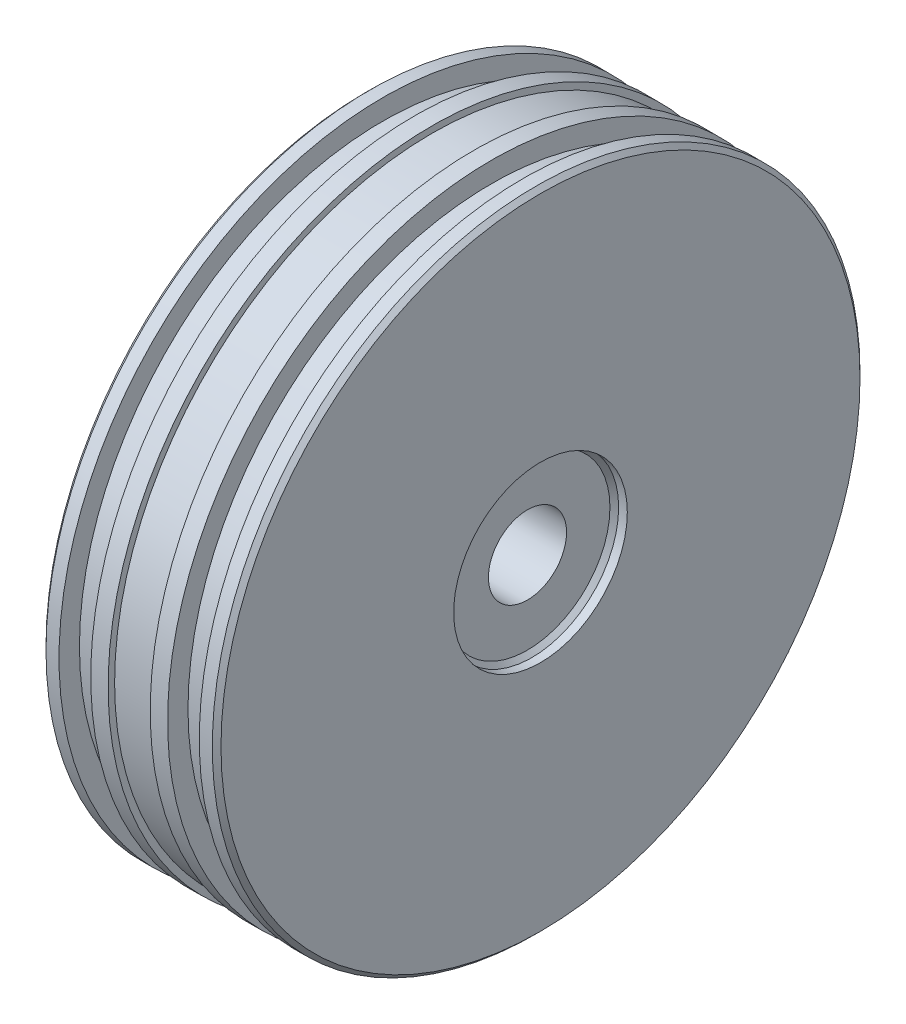
from build123d import *

# Parameters (mm, degrees)
CHAMFER_1_SIZE = 1
CHAMFER_2_SIZE = 3
CHAMFER_3_SIZE = 1


with BuildPart() as part:
    # Эскиз1 → Повернуть1 (revolve)
    with BuildSketch(Plane.XY, mode=Mode.PRIVATE) as revolve_1_sk:
        Polygon((0, 20), (0, 74.59), (4, 74.59), (4, 69.89), (11.3, 69.89), (11.3, 74.59), (15.3, 74.59), (15.3, 73.09), (25, 73.09), (25, 74.59), (29, 74.59), (29, 69.89), (36.3, 69.89), (36.3, 74.59), (40.3, 74.59), (40.3, 20), (37.3, 20), (37.3, 9), (15, 9), (15, 20), align=None)
    revolve(revolve_1_sk.sketch.rotate(Axis((0, 0, 0), (-1, 0, 0)), 90), axis=Axis((0, 0, 0), (-1, 0, 0)))

    # Фаска1
    chamfer_1_edges = [part.edges().sort_by_distance(p)[0] for p in [
        (40.3, 0, 74.59),
        (0, 0, 74.59),
    ]]
    chamfer(chamfer_1_edges, length=CHAMFER_1_SIZE)

    # Фаска2
    chamfer_2_edges = [part.edges().sort_by_distance(p)[0] for p in [
        (15, 0, 20),
    ]]
    chamfer(chamfer_2_edges, length=CHAMFER_2_SIZE)

    # Фаска3
    chamfer_3_edges = [part.edges().sort_by_distance(p)[0] for p in [
        (37.3, 0, 20),
        (0, 0, 20),
    ]]
    chamfer(chamfer_3_edges, length=CHAMFER_3_SIZE)


solid = part.part
